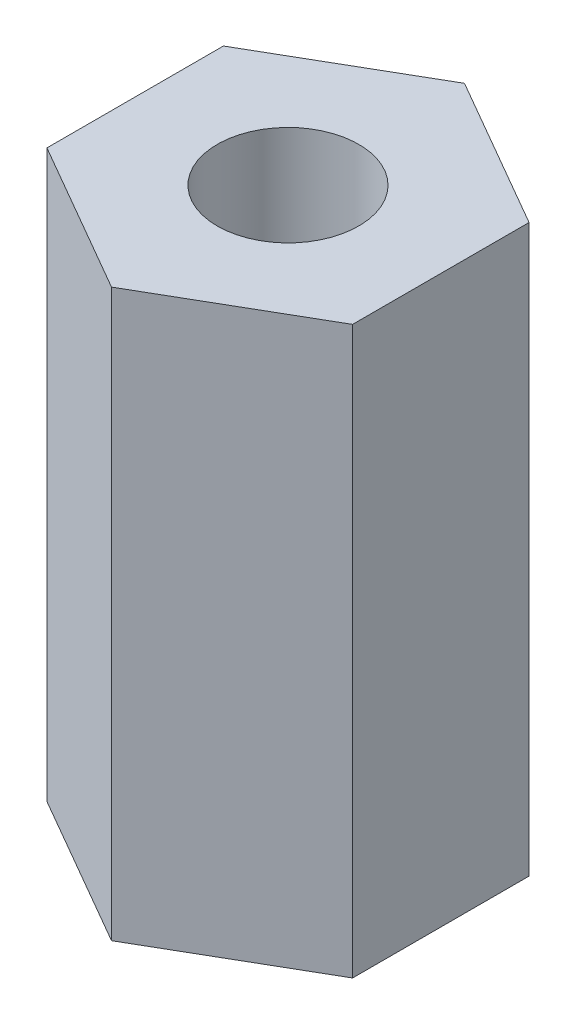
from build123d import *

# Parameters (mm, degrees)
BOSS_EXTRUDE1_DEPTH   = 10
M3X0_5_TAPPED_HOLE2_D = 2.5


with BuildPart() as part:
    # Sketch1 → Boss-Extrude1 (new body)
    with BuildSketch(Plane(origin=(0, 0, 0), x_dir=(1, 0, 0), z_dir=(0, 1, 0))):
        Polygon((0, 3.117691454), (-2.7, 1.558845727), (-2.7, -1.558845727), (0, -3.117691454), (2.7, -1.558845727), (2.7, 1.558845727), align=None)
    extrude(amount=BOSS_EXTRUDE1_DEPTH)

    # M3x0.5 Tapped Hole2 (through all)
    with Locations(Plane(origin=(0, 10, 0), x_dir=(1, 0, 0), z_dir=(0, 1, 0))):
        with Locations((0, 0)):
            Hole(M3X0_5_TAPPED_HOLE2_D / 2)


solid = part.part
